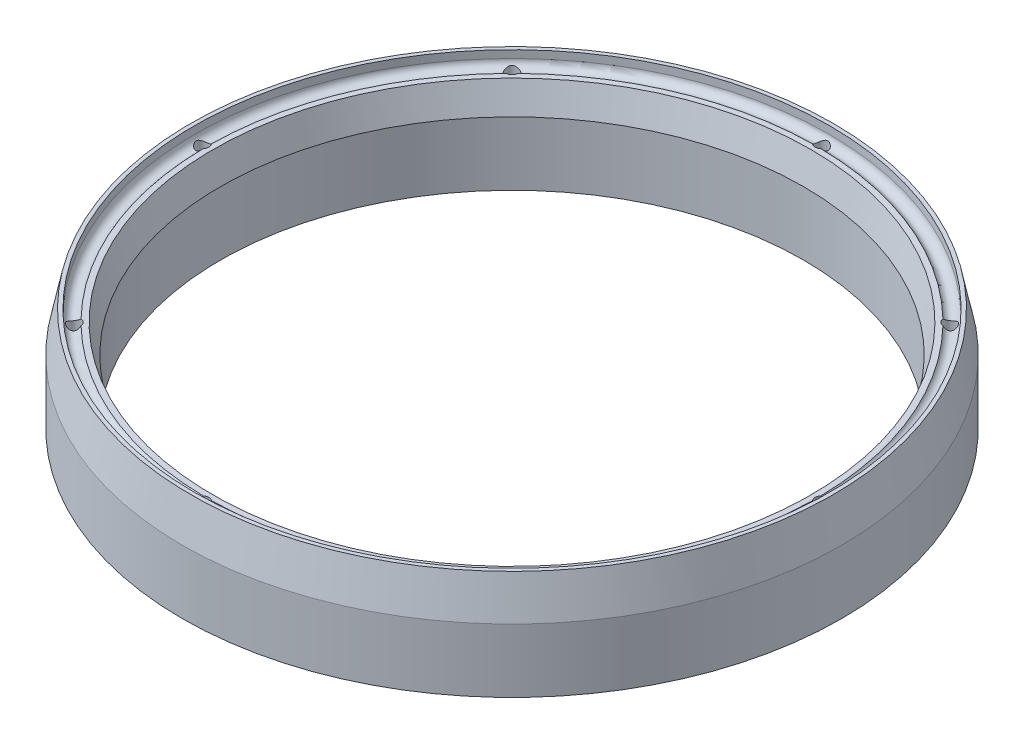
from build123d import *

# Parameters (mm, degrees)
SKETCH8_R             = 1.825
M4X0_7_TAPPED_HOLE1_D = 3.3
CIRPATTERN1_COUNT     = 8


with BuildPart() as part:
    # Sketch3 → Revolve1 (revolve)
    with BuildSketch(Plane.XY):
        Polygon((86.2847, 16.644516882), (86.2847, 0), (76.2847, 0), (76.2847, 16.644516882), (78.5347, 25.041631199), (84.0347, 25.041631199), align=None)
    revolve(axis=Axis((0, 0, 0), (0, 1, 0)))

    # Sketch8 → Cut-Revolve1 (revolve, cut)
    with BuildSketch(Plane.XY):
        with Locations((81.2847, 25.041631199)):
            Circle(SKETCH8_R)
    revolve(axis=Axis((0, 0, 0), (0, 1, 0)), mode=Mode.SUBTRACT)

    # Sketch15 → Cut-Revolve3 (revolve, cut)
    with BuildSketch(Plane.XY):
        Polygon((81.2847, 25.041631199), (78.5347, 25.041631199), (78.266750808, 24.041631199), (81.2847, 24.041631199), align=None)
    revolve(axis=Axis((0, 0, 0), (0, 1, 0)), mode=Mode.SUBTRACT)

    # Sketch17 → Revolve3 (revolve)
    with BuildSketch(Plane.XY):
        Polygon((84.1097, 27.041631199), (83.1097, 27.041631199), (83.1097, 25.041631199), (84.0347, 25.041631199), (86.2847, 16.644516882), align=None)
    revolve(axis=Axis((0, 0, 0), (0, 1, 0)))

    # M4x0.7 Tapped Hole1 (through all)
    with Locations(Plane(origin=(0, 0, 0), x_dir=(-1, 0, 0), z_dir=(0, -1, 0))):
        with Locations((0, -81)):
            m4x0_7_tapped_hole1 = Hole(M4X0_7_TAPPED_HOLE1_D / 2)

    # CirPattern1: M4x0.7 Tapped Hole1 ×8 about axis
    cirpattern1_axis = Axis((0, 0, 0), (0, -1, 0))
    for i in range(1, CIRPATTERN1_COUNT):
        add(m4x0_7_tapped_hole1.rotate(cirpattern1_axis, i * 360 / CIRPATTERN1_COUNT), mode=Mode.SUBTRACT)


solid = part.part
